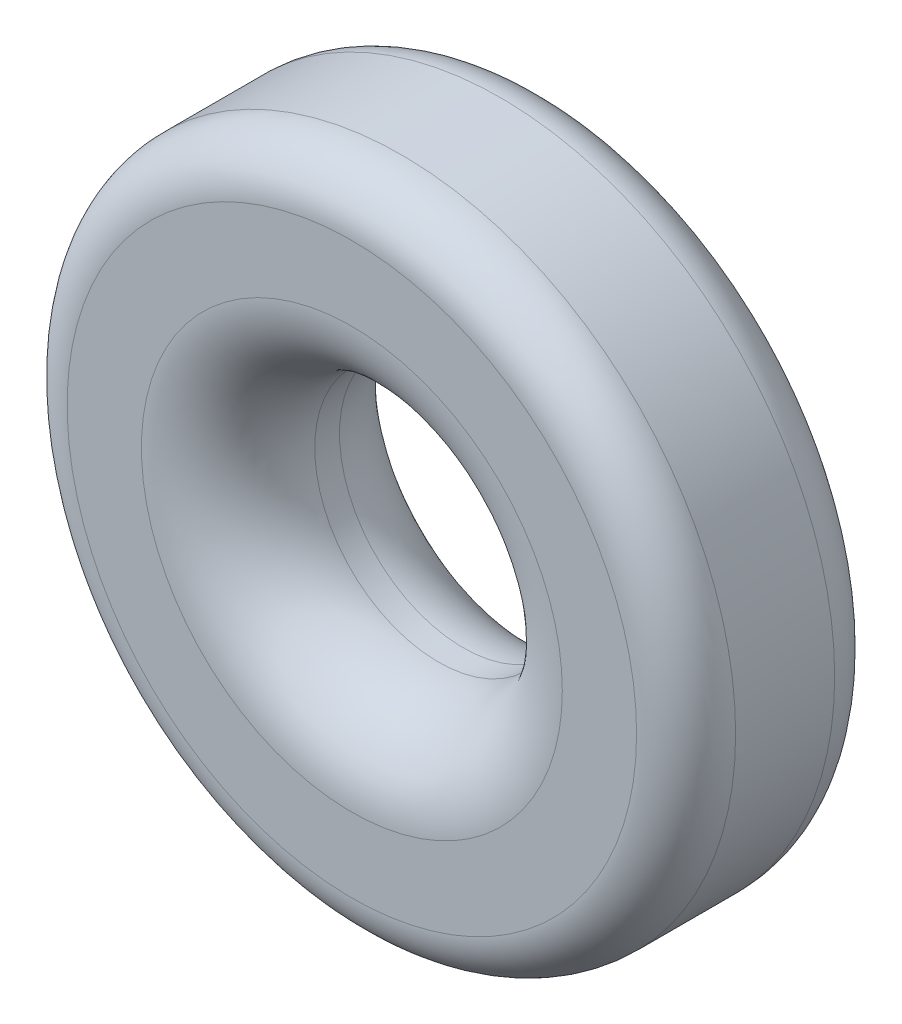
from build123d import *

# Parameters (mm, degrees)
SKETCH_1_R      = 135
SKETCH_1_R_2    = 50
EXTRUDE_1_DEPTH = 80
FILLET_4_R      = 20
FILLET_5_R      = 20
FILLET_6_R      = 35
FILLET_7_R      = 35


with BuildPart() as part:
    # Эскиз1 → Вытянуть1 (new body)
    with BuildSketch(Plane.XY):
        Circle(SKETCH_1_R)
        Circle(SKETCH_1_R_2, mode=Mode.SUBTRACT)
    extrude(amount=EXTRUDE_1_DEPTH)

    # Скругление4
    fillet_4_edges = [part.edges().sort_by_distance(p)[0] for p in [
        (-135, 0, 0),
    ]]
    fillet(fillet_4_edges, radius=FILLET_4_R)

    # Скругление5
    fillet_5_edges = [part.edges().sort_by_distance(p)[0] for p in [
        (-135, 0, 80),
    ]]
    fillet(fillet_5_edges, radius=FILLET_5_R)

    # Скругление6
    fillet_6_edges = [part.edges().sort_by_distance(p)[0] for p in [
        (-50, 0, 0),
    ]]
    fillet(fillet_6_edges, radius=FILLET_6_R)

    # Скругление7
    fillet_7_edges = [part.edges().sort_by_distance(p)[0] for p in [
        (-50, 0, 80),
    ]]
    fillet(fillet_7_edges, radius=FILLET_7_R)


solid = part.part
